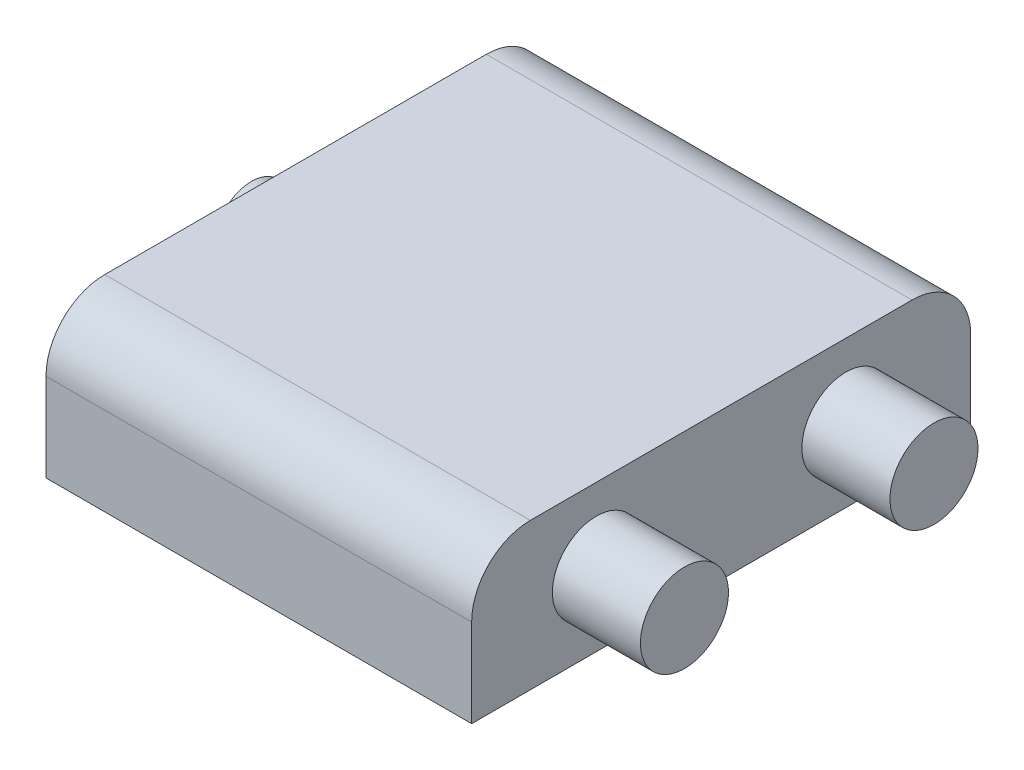
from build123d import *

# Parameters (mm, degrees)
ESBO_O1_W                = 34
ESBO_O1_H                = 10
RESSALTO_EXTRUS_O1_DEPTH = 29
FILETE1_R                = 4
ESBO_O2_R                = 3
RESSALTO_EXTRUS_O2_DEPTH = 6
ESBO_O3_R                = 2.5
RESSALTO_EXTRUS_O3_DEPTH = 3


with BuildPart() as part:
    # Esboço1 → Ressalto-extrusão1 (new body)
    with BuildSketch(Plane(origin=(0, 0, 0), x_dir=(0, 0, -1), z_dir=(1, 0, 0))):
        Rectangle(ESBO_O1_W, ESBO_O1_H)
    extrude(amount=RESSALTO_EXTRUS_O1_DEPTH)

    # Filete1
    filete1_edges = [part.edges().sort_by_distance(p)[0] for p in [
        (14.5, 5, 17),
        (14.5, 5, -17),
    ]]
    fillet(filete1_edges, radius=FILETE1_R)

    # Esboço2 → Ressalto-extrusão2 (add)
    with BuildSketch(Plane(origin=(29, 0, 0), x_dir=(0, 0, -1), z_dir=(1, 0, 0))):
        with Locations((-8.5, 0)):
            Circle(ESBO_O2_R)
        with Locations((8.5, 0)):
            Circle(ESBO_O2_R)
    extrude(amount=RESSALTO_EXTRUS_O2_DEPTH)

    # Esboço3 → Ressalto-extrusão3 (add)
    with BuildSketch(Plane.ZY):
        with Locations(Location((0, 0, 0), (0, 0, 180))):
            Circle(ESBO_O3_R)
    extrude(amount=RESSALTO_EXTRUS_O3_DEPTH)


solid = part.part
